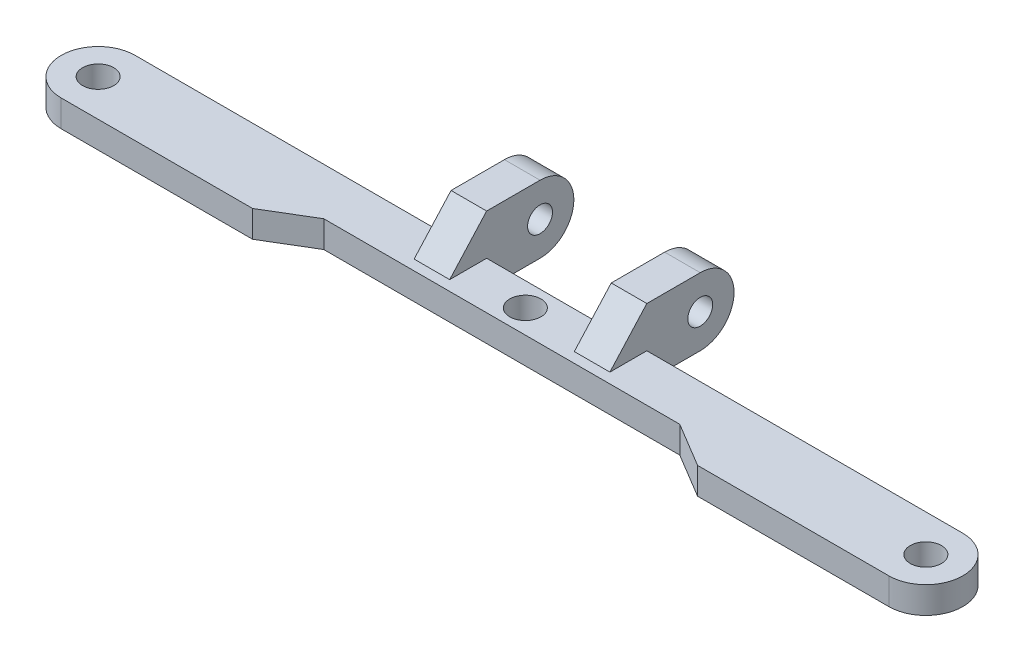
from build123d import *

# Parameters (mm, degrees)
SCHIZZO1_R                   = 1.75
ESTRUSIONE_ESTRUSIONE1_DEPTH = 3
ESTRUSIONE_ESTRUSIONE2_START = 11
SCHIZZO2_R                   = 1.4
ESTRUSIONE_ESTRUSIONE2_DEPTH = 4
TAGLIO_ESTRUSIONE1_DEPTH     = 53.736941512
SCHIZZO4_R                   = 1.75
TAGLIO_ESTRUSIONE2_DEPTH     = 53.736941512


with BuildPart() as part:
    # Schizzo1 → Estrusione-Estrusione1 (new body)
    with BuildSketch(Plane(origin=(0, 0, 0), x_dir=(1, 0, 0), z_dir=(0, 1, 0))):
        with BuildLine():
            Line((-46.5, -4.15), (46.5, -4.15))
            ThreePointArc((46.5, -4.15), (50.65, 0), (46.5, 4.15))
            Line((46.5, 4.15), (-46.5, 4.15))
            ThreePointArc((-46.5, 4.15), (-50.65, 0), (-46.5, -4.15))
        make_face()
        with Locations(Location((46.5, 0, 0), (0, 0, 270))):
            Circle(SCHIZZO1_R, mode=Mode.SUBTRACT)
        with Locations(Location((-46.5, 0, 0), (0, 0, 270))):
            Circle(SCHIZZO1_R, mode=Mode.SUBTRACT)
    extrude(amount=ESTRUSIONE_ESTRUSIONE1_DEPTH)

    # Schizzo2 → Estrusione-Estrusione2 (add)
    with BuildSketch(Plane(origin=(0, 0, 0), x_dir=(0, 0, -1), z_dir=(1, 0, 0)).offset(ESTRUSIONE_ESTRUSIONE2_START)):
        with BuildLine():
            Line((10.15, 7.6), (4.15, 7.6))
            Line((4.15, 7.6), (0, 3))
            Line((0, 3), (4.15, 3))
            Line((4.15, 3), (4.15, 0))
            Line((4.15, 0), (10.15, 0))
            ThreePointArc((10.15, 0), (13.95, 3.8), (10.15, 7.6))
        make_face()
        with Locations((10.15, 3.8)):
            Circle(SCHIZZO2_R, mode=Mode.SUBTRACT)
    estrusione_estrusione2 = extrude(amount=-ESTRUSIONE_ESTRUSIONE2_DEPTH)

    # Specchia1: Estrusione-Estrusione2 across plane
    add(estrusione_estrusione2.mirror(Plane(origin=(0, 0, 0), x_dir=(0, 0, 1), z_dir=(1, 0, 0))))

    # Schizzo3 → Taglio-Estrusione1 (cut, through all)
    with BuildSketch(Plane(origin=(0, 3, 0), x_dir=(1, 0, 0), z_dir=(0, 1, 0))):
        Polygon((-25, -4.15), (-20, -1.15), (20, -1.15), (25, -4.15), align=None)
    extrude(amount=-TAGLIO_ESTRUSIONE1_DEPTH, mode=Mode.SUBTRACT)

    # Schizzo4 → Taglio-Estrusione2 (cut, through all)
    with BuildSketch(Plane(origin=(0, 3, 0), x_dir=(1, 0, 0), z_dir=(0, 1, 0))):
        with Locations(Location((0, 1.5, 0), (0, 0, 270))):
            Circle(SCHIZZO4_R)
    extrude(amount=-TAGLIO_ESTRUSIONE2_DEPTH, mode=Mode.SUBTRACT)


solid = part.part
